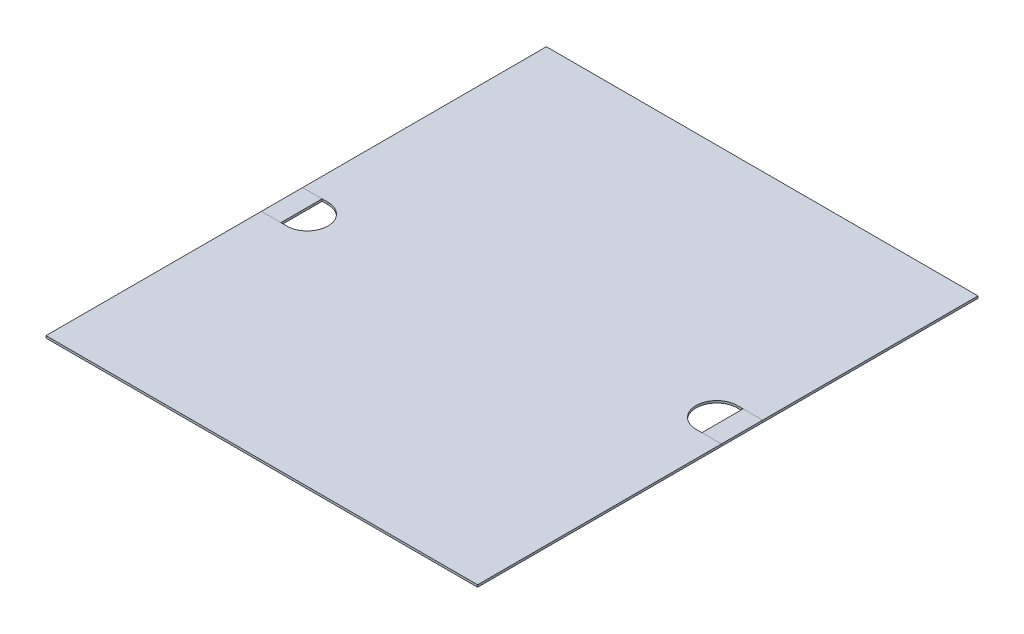
from build123d import *

# Parameters (mm, degrees)
BOSS_EXTRUDE1_DEPTH   = 1
SKETCH2_W             = 9
SKETCH2_H             = 19
BOSS_EXTRUDE2_DEPTH   = 1
BOSS_EXTRUDE2_2_DEPTH = 1


with BuildPart() as part:
    # Sketch1 → Boss-Extrude1 (new body)
    with BuildSketch(Plane(origin=(0, 0, 0), x_dir=(1, 0, 0), z_dir=(0, 1, 0))):
        with BuildLine():
            Line((0, 0), (199, 0))
            Line((199, 0), (198.959369161, 112.45))
            Line((198.959369161, 112.45), (187.25, 112.45))
            ThreePointArc((187.25, 112.45), (177.75, 121.95), (187.25, 131.45))
            Line((187.25, 131.45), (198.959369161, 131.45))
            Line((198.959369161, 131.45), (199, 230.7))
            Line((199, 230.7), (0, 230.7))
            Line((0, 230.7), (0.040630839, 118.25))
            Line((0.040630839, 118.25), (11.75, 118.25))
            ThreePointArc((11.75, 118.25), (21.25, 108.75), (11.75, 99.25))
            Line((11.75, 99.25), (0.040630839, 99.25))
            Line((0.040630839, 99.25), (0, 0))
        make_face()
    extrude(amount=BOSS_EXTRUDE1_DEPTH)


with BuildPart() as body_2:
    # Sketch2 → Boss-Extrude2 (new, through all)
    with BuildSketch(Plane(origin=(0, 1, 0), x_dir=(1, 0, 0), z_dir=(0, 1, 0))):
        with Locations((4.540630839, 108.75)):
            Rectangle(SKETCH2_W, SKETCH2_H)
    extrude(amount=-BOSS_EXTRUDE2_DEPTH)


with BuildPart() as body_3:
    # Sketch2 → Boss-Extrude2 2 (new, through all)
    with BuildSketch(Plane(origin=(0, 1, 0), x_dir=(1, 0, 0), z_dir=(0, 1, 0))):
        with Locations((194.459369161, 121.95)):
            Rectangle(SKETCH2_W, SKETCH2_H)
    extrude(amount=-BOSS_EXTRUDE2_2_DEPTH)


solid = Compound([part.part, body_2.part, body_3.part])
